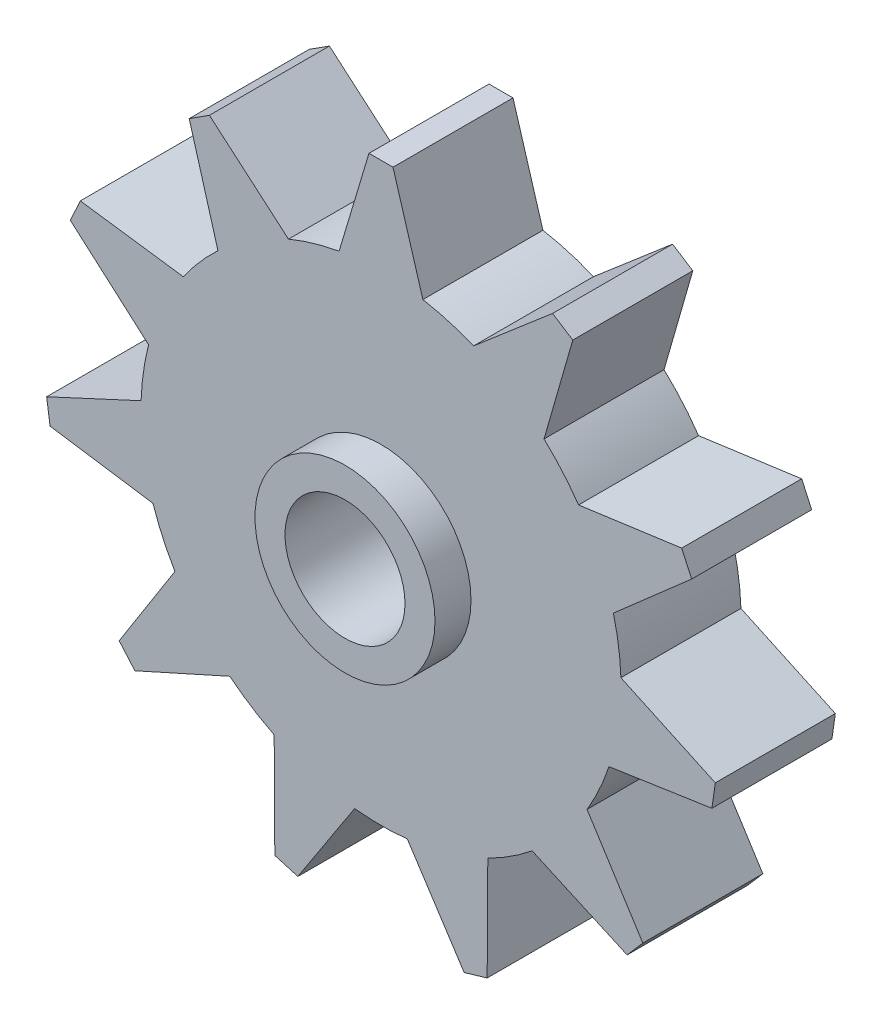
from build123d import *

# Parameters (mm, degrees)
SKETCH1_R                = 20
BOSS_EXTRUDE1_DEPTH      = 10
BOSS_EXTRUDE2_DEPTH      = 3
BOSS_EXTRUDE2_DEPTH_BACK = 13
SKETCH2_R                = 7.5
CUT_EXTRUDE2_DEPTH       = 33.496153619
CUT_EXTRUDE2_DEPTH_BACK  = 33.496153619
SKETCH3_R                = 5
BOSS_EXTRUDE3_DEPTH      = 10


with BuildPart() as part:
    # Sketch1 → Boss-Extrude1 (new body)
    with BuildSketch(Plane.XY):
        Circle(SKETCH1_R)
    extrude(amount=BOSS_EXTRUDE1_DEPTH)

    # Sketch2 → Boss-Extrude2 (add, two sides: drawn at the far end of the back side and taken through both)
    with BuildSketch(Plane.XY.offset(10).offset(-BOSS_EXTRUDE2_DEPTH_BACK)):
        Circle(SKETCH2_R)
    extrude(amount=BOSS_EXTRUDE2_DEPTH + BOSS_EXTRUDE2_DEPTH_BACK)

    # Sketch3 → Cut-Extrude2 (cut, two sides: drawn at the far end of the back side and taken through both)
    with BuildSketch(Plane.XY.offset(13).offset(-CUT_EXTRUDE2_DEPTH_BACK)):
        Circle(SKETCH3_R)
    extrude(amount=CUT_EXTRUDE2_DEPTH + CUT_EXTRUDE2_DEPTH_BACK, mode=Mode.SUBTRACT)

    # Sketch4 → Boss-Extrude3 (add)
    with BuildSketch(Plane.XY.offset(10)):
        Polygon((-1, 28), (1, 28), (4, 18), (-4, 18), align=None)
        Polygon((6.366520583, 17.305126861), (14.296689356, 24.095739737), (15.979196422, 23.014458102), (13.096548846, 12.980000321), align=None)
        Polygon((14.711715864, 11.115998215), (25.054280857, 12.541252359), (25.885110883, 10.721988369), (18.035035968, 3.838942253), align=None)
        Polygon((18.386045307, 1.397618679), (27.857315211, -2.99499403), (27.572685534, -4.974636914), (17.247526601, -6.520952856), align=None)
        Polygon((16.222935274, -8.764494914), (21.815848816, -17.580350976), (20.506127348, -19.091850125), (10.984049403, -14.810491508), align=None)
        Polygon((8.909157918, -16.143943298), (8.848004565, -26.584070704), (6.929018618, -27.147535818), (1.233214129, -18.397803752), align=None)
        Polygon((-1.233214129, -18.397803752), (-6.929018618, -27.147535818), (-8.848004565, -26.584070704), (-8.909157918, -16.143943298), align=None)
        Polygon((-10.984049403, -14.810491508), (-20.506127348, -19.091850125), (-21.815848816, -17.580350976), (-16.222935274, -8.764494914), align=None)
        Polygon((-17.247526601, -6.520952856), (-27.572685534, -4.974636914), (-27.857315211, -2.99499403), (-18.386045307, 1.397618679), align=None)
        Polygon((-18.035035968, 3.838942253), (-25.885110883, 10.721988369), (-25.054280857, 12.541252359), (-14.711715864, 11.115998215), align=None)
        Polygon((-13.096548846, 12.980000321), (-15.979196422, 23.014458102), (-14.296689356, 24.095739737), (-6.366520583, 17.305126861), align=None)
    extrude(amount=-BOSS_EXTRUDE3_DEPTH)


solid = part.part
